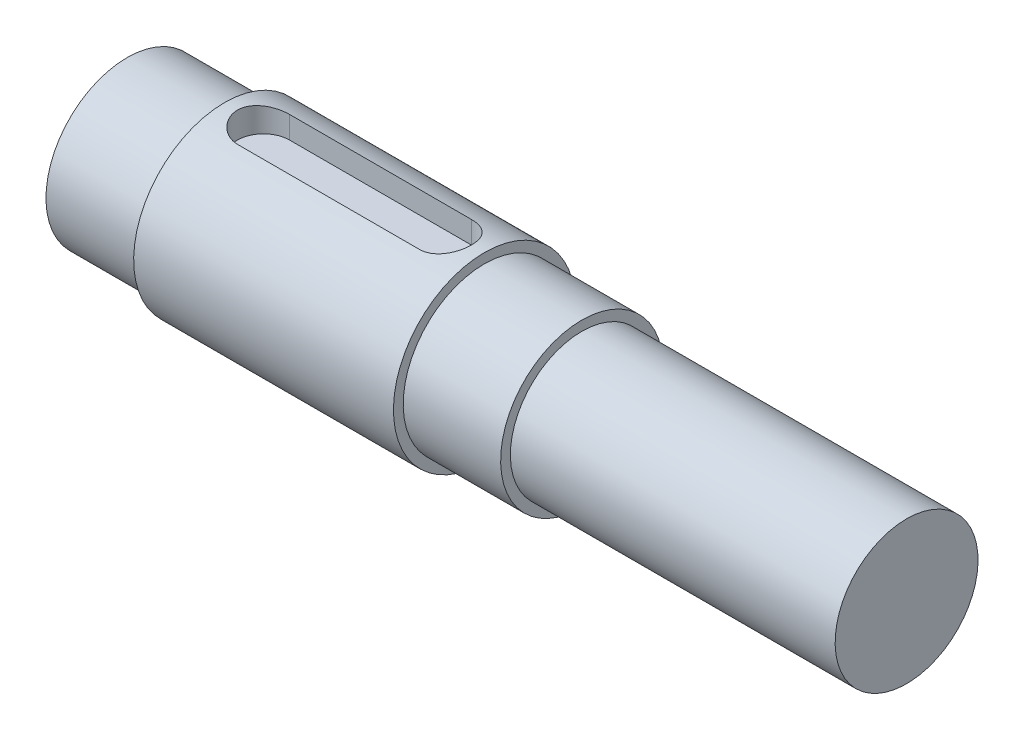
from build123d import *

# Parameters (mm, degrees)
CUT_EXTRUDE_START   = 10
CUT_EXTRUDE_1_DEPTH = 112.622366364


with BuildPart() as part:
    # Эскиз1 → Повернуть1 (revolve)
    with BuildSketch(Plane.XY):
        Polygon((0, 0), (0, 12.5), (15, 12.5), (15, 14), (55, 14), (55, 12.5), (70, 12.5), (70, 11), (120, 11), (120, 0), align=None)
    revolve(axis=Axis((120, 0, 0), (-1, 0, 0)))

    # Эскиз3 → Вырез-Вытянуть1 (cut, through all)
    with BuildSketch(Plane(origin=(0, 0, 0), x_dir=(1, 0, 0), z_dir=(0, 1, 0)).offset(CUT_EXTRUDE_START)):
        with BuildLine():
            Line((21, 4), (49, 4))
            ThreePointArc((49, 4), (53, 0), (49, -4))
            Line((49, -4), (21, -4))
            ThreePointArc((21, -4), (17, 0), (21, 4))
        make_face()
    extrude(amount=CUT_EXTRUDE_1_DEPTH, mode=Mode.SUBTRACT)


solid = part.part
